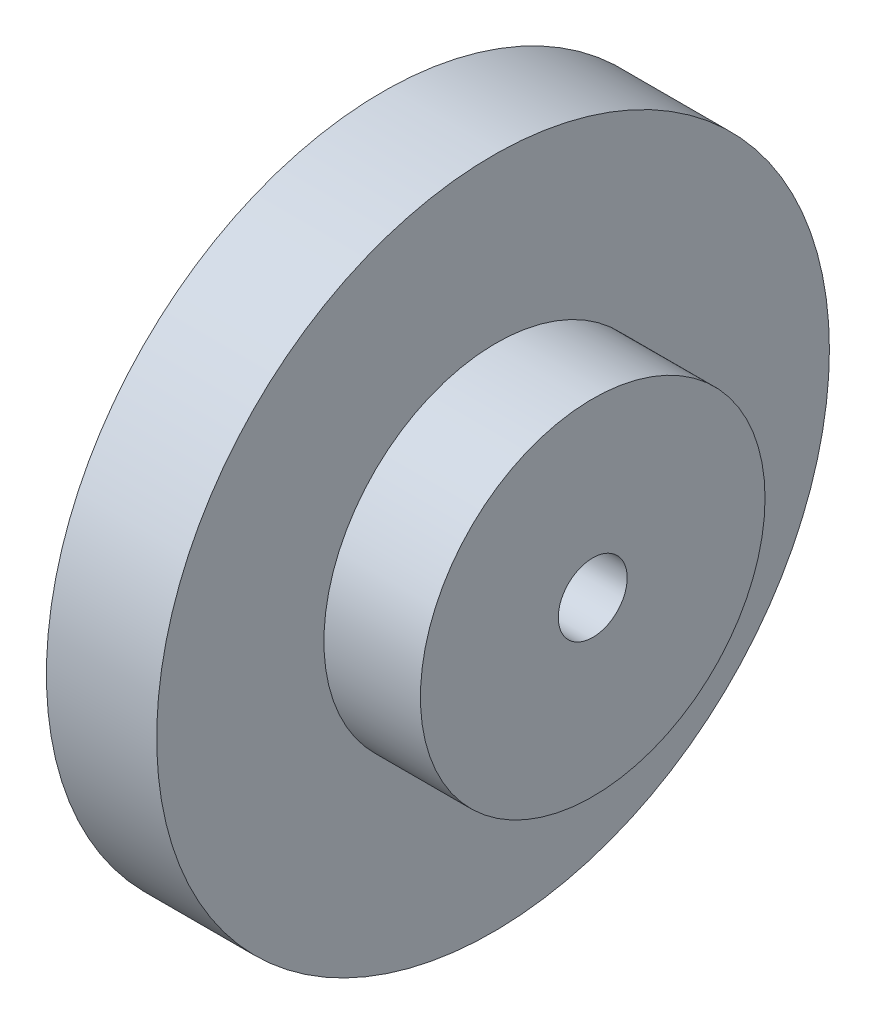
from build123d import *

# Parameters (mm, degrees)
SKETCH1_R           = 24.4
SKETCH1_R_2         = 2.5
BOSS_EXTRUDE1_DEPTH = 8
SKETCH2_R           = 12.5
SKETCH2_R_2         = 2.5
BOSS_EXTRUDE3_DEPTH = 7


with BuildPart() as part:
    # Sketch1 → Boss-Extrude1 (new body)
    with BuildSketch(Plane(origin=(0, 0, 0), x_dir=(0, 0, -1), z_dir=(1, 0, 0))):
        with Locations((0, -0.19719949)):
            Circle(SKETCH1_R)
        with Locations((0.230786774, -0.19719949)):
            Circle(SKETCH1_R_2, mode=Mode.SUBTRACT)
    extrude(amount=BOSS_EXTRUDE1_DEPTH)

    # Sketch2 → Boss-Extrude3 (add)
    with BuildSketch(Plane(origin=(8, 0, 0), x_dir=(0, 0, -1), z_dir=(1, 0, 0))):
        with Locations((0.230786774, -0.19719949)):
            Circle(SKETCH2_R)
        with Locations((0.230786774, -0.19719949)):
            Circle(SKETCH2_R_2, mode=Mode.SUBTRACT)
    extrude(amount=BOSS_EXTRUDE3_DEPTH)


solid = part.part
